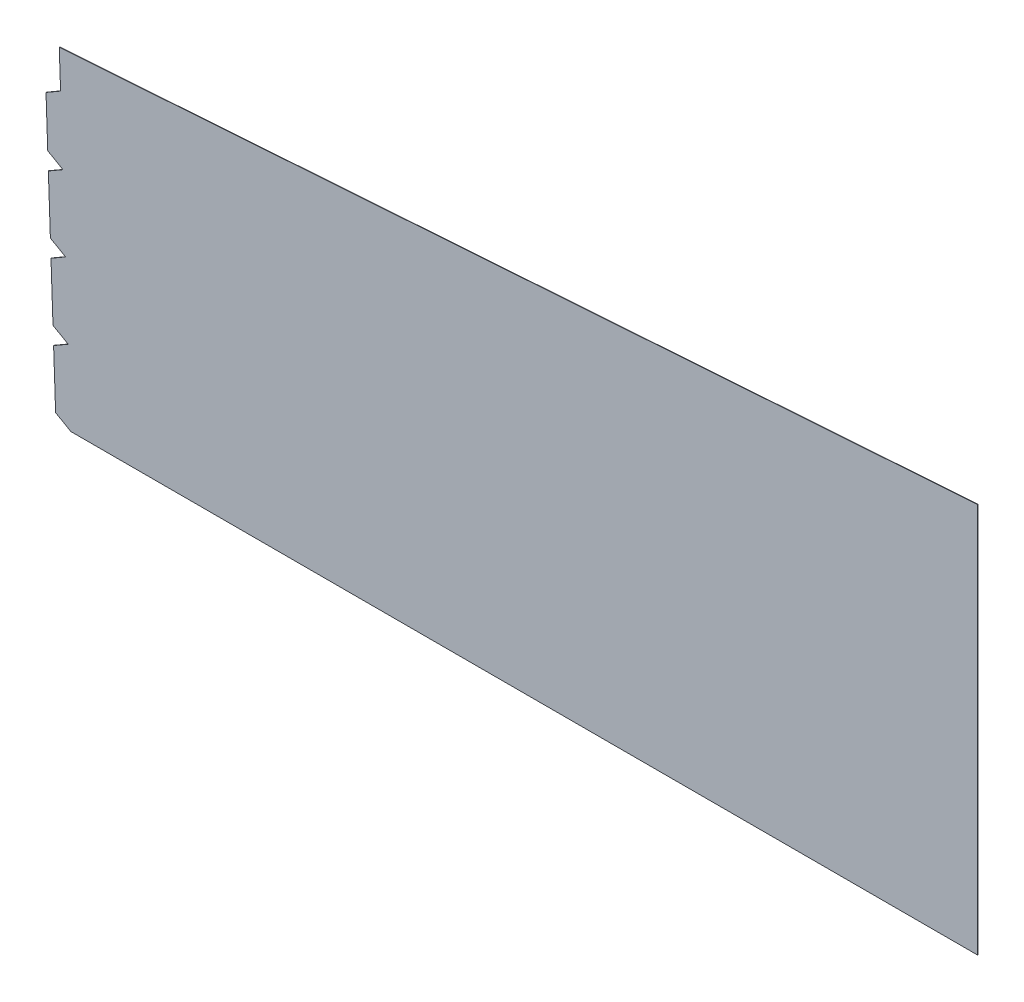
from build123d import *

# Parameters (mm, degrees)
EXTRUDE1_DEPTH = 0.762


with BuildPart() as part:
    # Sketch1 → Extrude1 (new body)
    with BuildSketch(Plane.XY):
        Polygon((0, 0), (1549.4, 0), (1549.4, 666.75), (-19.727892949, 558.8), (-17.4752, 494.99162355), (-42.383326854, 480.610909806), (-39.387109946, 395.741937088), (-13.442461538, 380.762787346), (-38.350588393, 366.382073602), (-34.906289433, 268.821007973), (-8.961641026, 253.841858231), (-33.86976788, 239.461144487), (-30.42546892, 141.900078857), (-4.480820513, 126.920929115), (-29.388947367, 112.540215371), (-25.944648407, 14.979149742), align=None)
    extrude(amount=EXTRUDE1_DEPTH)


solid = part.part
